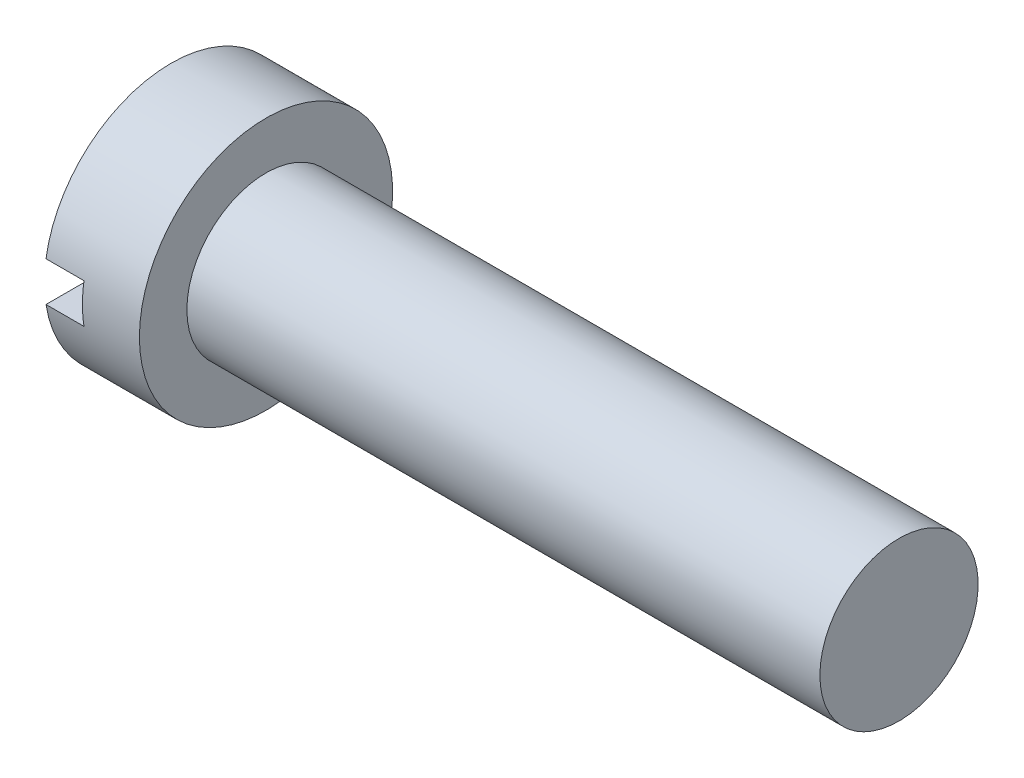
from build123d import *

# Parameters (mm, degrees)
SKETCH2_W  = 16
SKETCH2_H  = 2.5
SLOT_DEPTH = 2.4


with BuildPart() as part:
    # BodySke → Base-Revolve (revolve)
    with BuildSketch(Plane.XY, mode=Mode.PRIVATE) as base_revolve_sk:
        Polygon((6, 5), (6, 8), (0, 8), (0, 0), (46, 0), (46, 5), align=None)
    revolve(base_revolve_sk.sketch.rotate(Axis((-25.4, 0, 0), (1, 0, 0)), 90), axis=Axis((-25.4, 0, 0), (1, 0, 0)))

    # Sketch2 → Slot (cut)
    with BuildSketch(Plane(origin=(0, 0, 0), x_dir=(0, 0, -1), z_dir=(1, 0, 0))):
        Rectangle(SKETCH2_W, SKETCH2_H)
    extrude(amount=SLOT_DEPTH, mode=Mode.SUBTRACT)


solid = part.part
